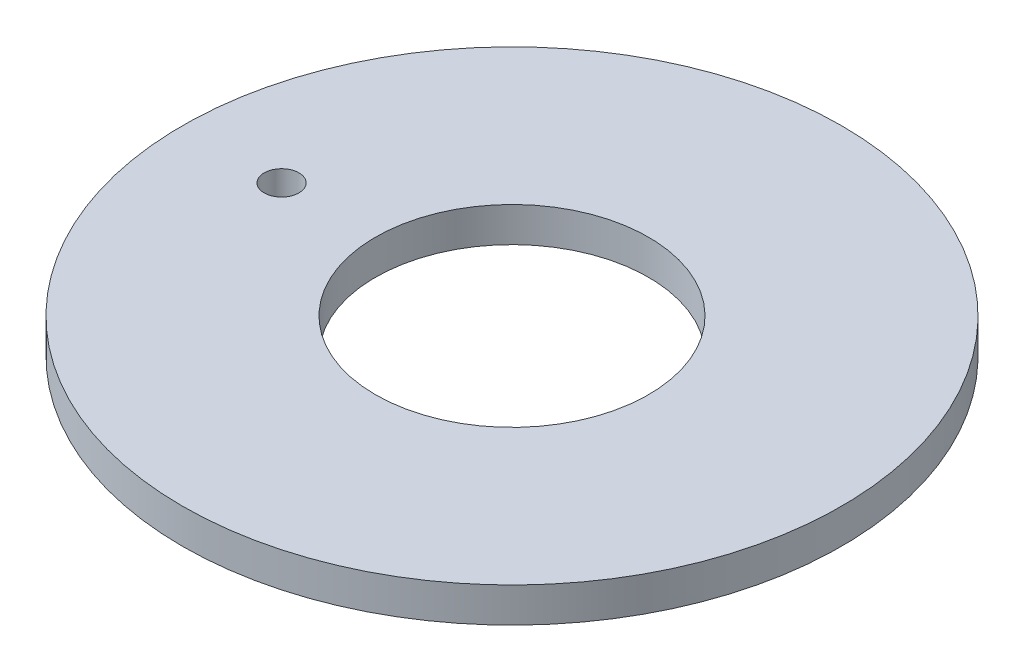
from build123d import *

# Parameters (mm, degrees)
SKETCH1_R           = 37.9
SKETCH1_R_2         = 15.7
BOSS_EXTRUDE1_DEPTH = 4
SKETCH2_R           = 2
CUT_EXTRUDE1_DEPTH  = 54.747744139


with BuildPart() as part:
    # Sketch1 → Boss-Extrude1 (new body)
    with BuildSketch(Plane(origin=(0, 0, 0), x_dir=(1, 0, 0), z_dir=(0, 1, 0))):
        with Locations(Location((0, 0, 0), (0, 0, 270))):
            Circle(SKETCH1_R)
        with Locations(Location((0, 0, 0), (0, 0, 270))):
            Circle(SKETCH1_R_2, mode=Mode.SUBTRACT)
    extrude(amount=BOSS_EXTRUDE1_DEPTH)

    # Sketch2 → Cut-Extrude1 (cut, through all)
    with BuildSketch(Plane(origin=(0, 4, 0), x_dir=(1, 0, 0), z_dir=(0, 1, 0))):
        with Locations(Location((-26.5, 0, 0), (0, 0, 270))):
            Circle(SKETCH2_R)
    extrude(amount=-CUT_EXTRUDE1_DEPTH, mode=Mode.SUBTRACT)


solid = part.part
